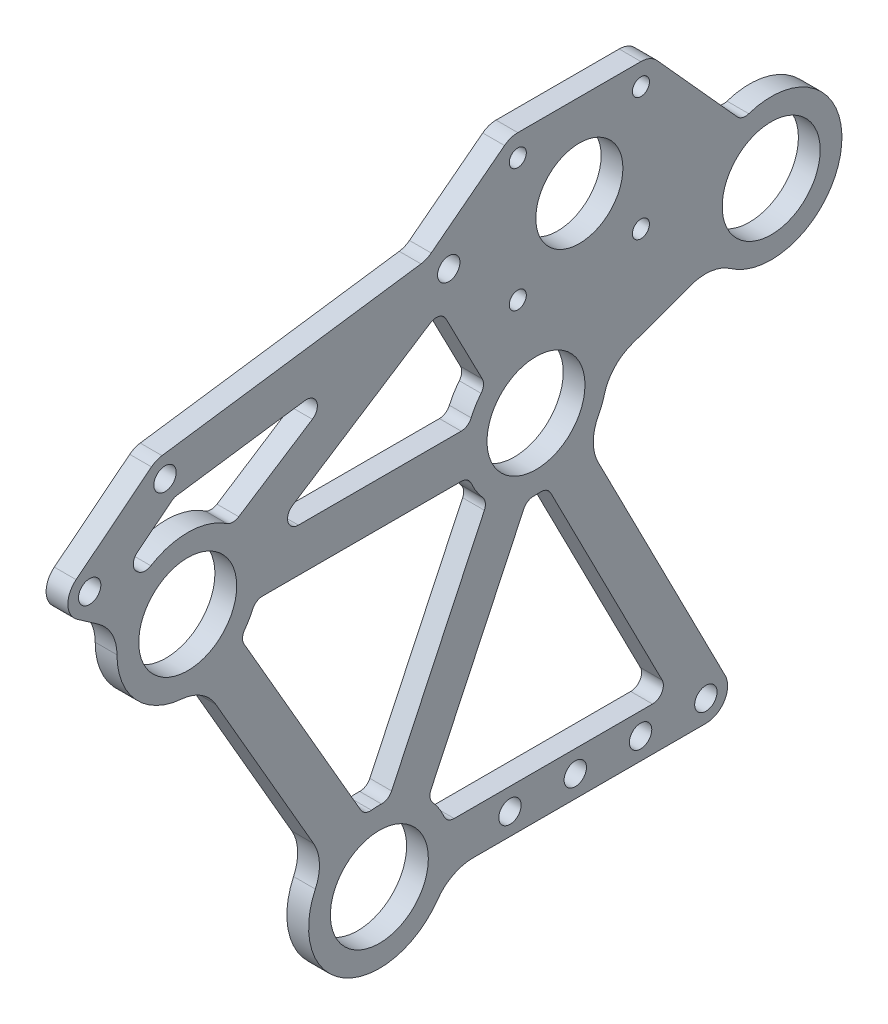
from build123d import *

# Parameters (mm, degrees)
SKETCH1_R           = 14.2875
SKETCH1_R_2         = 3.2639
SKETCH1_R_3         = 2.4892
SKETCH1_R_4         = 12.7
BOSS_EXTRUDE1_DEPTH = 6.35
FILLET1_R           = 12.7
CUT_EXTRUDE1_DEPTH  = 1118.158262331
FILLET2_R           = 3.175


with BuildPart() as part:
    # Sketch1 → Boss-Extrude1 (new body)
    with BuildSketch(Plane(origin=(0, 0, 0), x_dir=(0, 0, -1), z_dir=(1, 0, 0))):
        with BuildLine():
            ThreePointArc((-977.470329324, 488.018353149), (-979.865093402, 482.854765121), (-977.16025221, 477.846634687))
            Line((-977.16025221, 477.846634687), (-964.636474603, 469.0773912))
            ThreePointArc((-964.636474603, 469.0773912), (-960.124717731, 449.073600219), (-940.590272736, 442.835566684))
            Line((-940.590272736, 442.835566684), (-904.317406585, 380.009119575))
            ThreePointArc((-904.317406585, 380.009119575), (-899.31875, 348.305993858), (-869.363709458, 359.828593129))
            Line((-869.363709458, 359.828593129), (-793.75, 359.828593129))
            ThreePointArc((-793.75, 359.828593129), (-788.33277515, 362.865562051), (-788.097264793, 369.071530162))
            Line((-788.097264793, 369.071530162), (-828.71050777, 448.428911911))
            ThreePointArc((-828.71050777, 448.428911911), (-824.098459608, 455.475832937), (-822.685744308, 463.778502368))
            Line((-822.685744308, 463.778502368), (-790.971974231, 475.344799559))
            ThreePointArc((-790.971974231, 475.344799559), (-754.671988994, 483.059997875), (-783.134686327, 506.873608979))
            Line((-783.134686327, 506.873608979), (-807.984116899, 534.429271156))
            ThreePointArc((-807.984116899, 534.429271156), (-810.119275968, 535.978683887), (-812.699834325, 536.526682631))
            Line((-812.699834325, 536.526682631), (-848.620858809, 536.526682631))
            ThreePointArc((-848.620858809, 536.526682631), (-850.667304495, 536.18788551), (-852.495378558, 535.207646428))
            Line((-852.495378558, 535.207646428), (-873.874828732, 518.742590175))
            ThreePointArc((-873.874828732, 518.742590175), (-875.286935498, 517.920433239), (-876.862092968, 517.485845513))
            Line((-876.862092968, 517.485845513), (-952.412407774, 506.824976977))
            ThreePointArc((-952.412407774, 506.824976977), (-954.033002966, 506.371065297), (-955.477439746, 505.507371499))
            Line((-955.477439746, 505.507371499), (-977.470329324, 488.018353149))
        make_face()
        with Locations((-774.7, 488.038469669)):
            Circle(SKETCH1_R, mode=Mode.SUBTRACT)
        with Locations((-843.309156693, 463.016093129)):
            Circle(SKETCH1_R, mode=Mode.SUBTRACT)
        with Locations((-889, 366.178593129)):
            Circle(SKETCH1_R, mode=Mode.SUBTRACT)
        with Locations((-944.909156693, 463.016093129)):
            Circle(SKETCH1_R, mode=Mode.SUBTRACT)
        with Locations((-850.9, 366.178593129)):
            Circle(SKETCH1_R_2, mode=Mode.SUBTRACT)
        with Locations((-831.85, 366.178593129)):
            Circle(SKETCH1_R_2, mode=Mode.SUBTRACT)
        with Locations((-812.8, 366.178593129)):
            Circle(SKETCH1_R_2, mode=Mode.SUBTRACT)
        with Locations((-793.75, 366.178593129)):
            Circle(SKETCH1_R_2, mode=Mode.SUBTRACT)
        with Locations((-973.518041839, 483.048250169)):
            Circle(SKETCH1_R_2, mode=Mode.SUBTRACT)
        with Locations((-951.525152262, 500.537268519)):
            Circle(SKETCH1_R_2, mode=Mode.SUBTRACT)
        with Locations((-868.760346567, 512.216170389)):
            Circle(SKETCH1_R_2, mode=Mode.SUBTRACT)
        with Locations((-848.620858809, 494.255658147)):
            Circle(SKETCH1_R_3, mode=Mode.SUBTRACT)
        with Locations((-812.699834325, 494.255658147)):
            Circle(SKETCH1_R_3, mode=Mode.SUBTRACT)
        with Locations((-830.660346567, 512.216170389)):
            Circle(SKETCH1_R_4, mode=Mode.SUBTRACT)
        with Locations((-848.620858809, 530.176682631)):
            Circle(SKETCH1_R_3, mode=Mode.SUBTRACT)
        with Locations((-812.699834325, 530.176682631)):
            Circle(SKETCH1_R_3, mode=Mode.SUBTRACT)
    extrude(amount=BOSS_EXTRUDE1_DEPTH)

    # Fillet1
    fillet1_edges = [part.edges().sort_by_distance(p)[0] for p in [
        (3.175, 475.344799559, 790.971974231),
        (3.175, 463.778502368, 822.685744308),
        (3.175, 448.428911911, 828.71050777),
        (3.175, 359.828593129, 869.363709458),
        (3.175, 380.009119575, 904.317406585),
        (3.175, 442.835566684, 940.590272736),
        (3.175, 469.0773912, 964.636474603),
    ]]
    fillet(fillet1_edges, radius=FILLET1_R)

    # Sketch2 → Cut-Extrude1 (cut, through all)
    with BuildSketch(Plane(origin=(6.35, 0, 0), x_dir=(0, 0, -1), z_dir=(1, 0, 0))):
        with BuildLine():
            Line((-948.926016287, 494.491122688), (-962.909028761, 483.371657877))
            Line((-962.909028761, 483.371657877), (-957.352053862, 479.480622163))
            ThreePointArc((-957.352053862, 479.480622163), (-944.524975807, 483.650016927), (-931.861993278, 479.00602537))
            Line((-931.861993278, 479.00602537), (-896.429960387, 501.898815853))
            Line((-896.429960387, 501.898815853), (-948.926016287, 494.491122688))
        make_face()
        with BuildLine():
            Line((-857.971369961, 477.539381611), (-871.187574345, 503.08782473))
            Line((-871.187574345, 503.08782473), (-914.338399947, 475.207888722))
            ThreePointArc((-914.338399947, 475.207888722), (-915.66067146, 471.642886863), (-912.615371721, 469.366093129))
            Line((-912.615371721, 469.366093129), (-862.945447235, 469.366093129))
            ThreePointArc((-862.945447235, 469.366093129), (-860.938606544, 473.744974907), (-857.971369961, 477.539381611))
        make_face()
        with BuildLine():
            ThreePointArc((-925.272866151, 456.666093129), (-927.036557422, 452.697343129), (-929.591750108, 449.185566684))
            Line((-929.591750108, 449.185566684), (-893.318883957, 386.359119575))
            ThreePointArc((-893.318883957, 386.359119575), (-889.853529885, 386.798435344), (-886.363723266, 386.647018844))
            Line((-886.363723266, 386.647018844), (-857.431129838, 447.966964226))
            ThreePointArc((-857.431129838, 447.966964226), (-860.739698931, 451.966993458), (-862.945447235, 456.666093129))
            Line((-862.945447235, 456.666093129), (-925.272866151, 456.666093129))
        make_face()
        with BuildLine():
            Line((-804.13305316, 372.528593129), (-840.015978185, 442.643037846))
            ThreePointArc((-840.015978185, 442.643037846), (-842.977262335, 442.381262081), (-845.945433426, 442.547667414))
            Line((-845.945433426, 442.547667414), (-874.878026855, 381.227722032))
            ThreePointArc((-874.878026855, 381.227722032), (-871.569457762, 377.2276928), (-869.363709458, 372.528593129))
            Line((-869.363709458, 372.528593129), (-804.13305316, 372.528593129))
        make_face()
    extrude(amount=-CUT_EXTRUDE1_DEPTH, mode=Mode.SUBTRACT)

    # Fillet2
    fillet2_edges = [part.edges().sort_by_distance(p)[0] for p in [
        (3.175, 479.00602537, 931.861993278),
        (3.175, 479.480622163, 957.352053862),
        (3.175, 483.371657877, 962.909028761),
        (3.175, 494.491122688, 948.926016287),
        (3.175, 501.898815853, 896.429960387),
        (3.175, 386.647018844, 886.363723266),
        (3.175, 386.359119575, 893.318883957),
        (3.175, 449.185566684, 929.591750108),
        (3.175, 456.666093129, 925.272866151),
        (3.175, 456.666093129, 862.945447235),
        (3.175, 447.966964226, 857.431129838),
        (3.175, 372.528593129, 869.363709458),
        (3.175, 381.227722032, 874.878026855),
        (3.175, 442.547667414, 845.945433426),
        (3.175, 442.643037846, 840.015978185),
        (3.175, 372.528593129, 804.13305316),
        (3.175, 503.08782473, 871.187574345),
        (3.175, 477.539381611, 857.971369961),
        (3.175, 469.366093129, 862.945447235),
        (3.175, 506.873608979, 783.134686327),
    ]]
    fillet(fillet2_edges, radius=FILLET2_R)


solid = part.part
